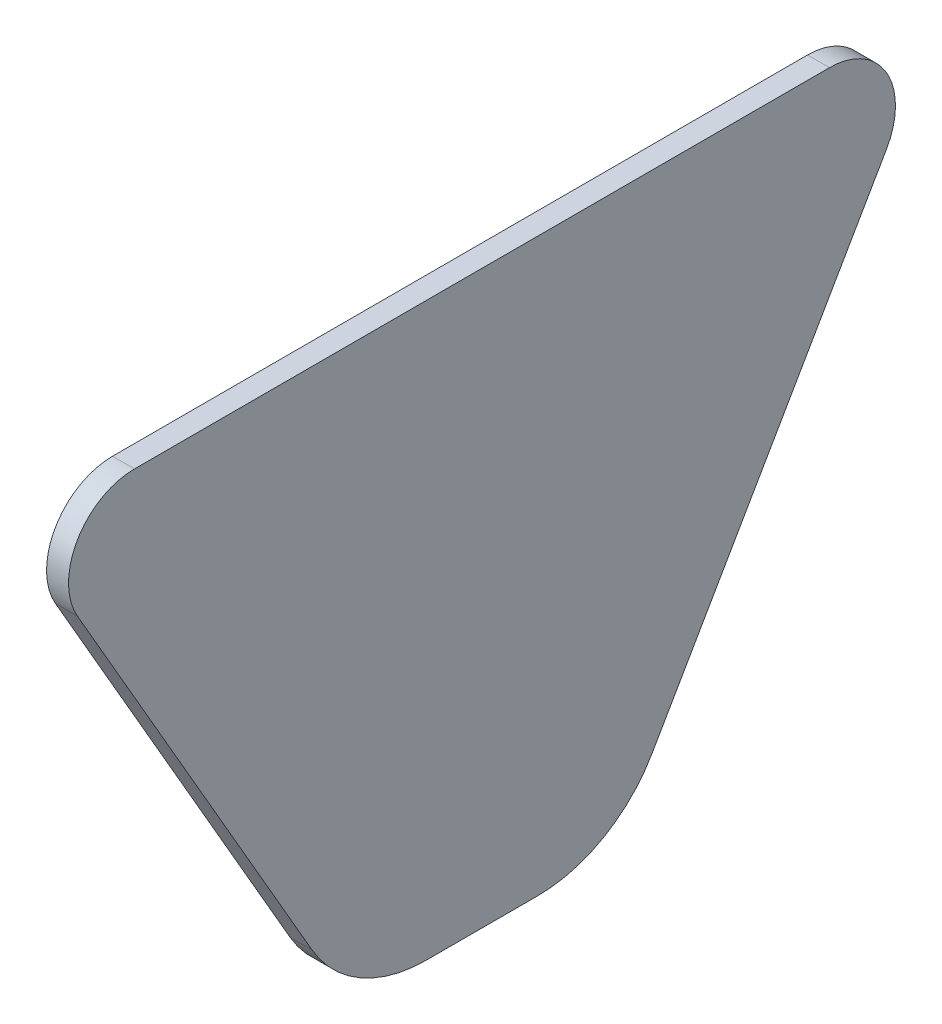
from build123d import *

# Parameters (mm, degrees)
EXTRUDE_1_DEPTH     = 0.5
EXTRUDE_2_DEPTH     = 2
FILLET_1_R          = 0.3
CUT_EXTRUDE_1_DEPTH = 0.05
CUT_EXTRUDE_2_DEPTH = 0.05
CUT_EXTRUDE_3_DEPTH = 0.05
SKETCH_6_R          = 0.4
SKETCH_6_R_2        = 0.3
CUT_EXTRUDE_4_DEPTH = 0.05


with BuildPart() as part:
    # Эскиз1 → Бобышка-Вытянуть1 (new, symmetric)
    with BuildSketch(Plane(origin=(0, 0, 0), x_dir=(0, 0, -1), z_dir=(1, 0, 0))):
        with BuildLine():
            Line((2.535898385, -52), (-2.535898385, -52))
            ThreePointArc((-2.535898385, -52), (-5.535898385, -51.196152423), (-7.732050808, -49))
            Line((-7.732050808, -49), (-18.413030788, -30.5))
            ThreePointArc((-18.413030788, -30.5), (-18.413030788, -27.5), (-15.814954576, -26))
            Line((-15.814954576, -26), (15.814954576, -26))
            ThreePointArc((15.814954576, -26), (18.413030788, -27.5), (18.413030788, -30.5))
            Line((18.413030788, -30.5), (7.732050808, -49))
            ThreePointArc((7.732050808, -49), (5.535898385, -51.196152423), (2.535898385, -52))
        make_face()
    extrude(amount=EXTRUDE_1_DEPTH, both=True)

    # Эскиз2 → Бобышка-Вытянуть2 (add)
    with BuildSketch(Plane.ZY.offset(0.5)):
        with BuildLine():
            Line((1.728674855, -43), (-1.728674855, -43))
            ThreePointArc((-1.728674855, -43), (-2.005954761, -43.039210817), (-2.261489924, -43.153768293))
            ThreePointArc((-2.261489924, -43.153768293), (-3.79502764, -44.668303078), (-4.548555907, -46.687646708))
            ThreePointArc((-4.548555907, -46.687646708), (-4.544377659, -46.993552015), (-4.447909552, -47.283878416))
            ThreePointArc((-4.447909552, -47.283878416), (0, -50), (4.447909552, -47.283878416))
            ThreePointArc((4.447909552, -47.283878416), (4.544377659, -46.993552015), (4.548555907, -46.687646708))
            ThreePointArc((4.548555907, -46.687646708), (3.79502764, -44.668303078), (2.261489924, -43.153768293))
            ThreePointArc((2.261489924, -43.153768293), (2.005954761, -43.039210817), (1.728674855, -43))
        make_face()
        with BuildLine():
            ThreePointArc((6.849999027, -30.437634022), (9.817391211, -29.83648895), (12.7337664, -29.023133227))
            ThreePointArc((12.7337664, -29.023133227), (13.636842461, -29.175983342), (14.036664122, -30.00002956))
            ThreePointArc((14.036664122, -30.00002956), (12.155161452, -36.681608438), (7.295503302, -41.638146673))
            ThreePointArc((7.295503302, -41.638146673), (4.194836252, -41.229561749), (3.91920073, -38.114260343))
            ThreePointArc((3.91920073, -38.114260343), (5.447269784, -34.910587582), (6.013250548, -31.406564185))
            ThreePointArc((6.013250548, -31.406564185), (6.256250043, -30.770649024), (6.849999027, -30.437634022))
        make_face()
        with BuildLine():
            ThreePointArc((-3.91920073, -38.114260343), (-5.447269784, -34.910587582), (-6.013250548, -31.406564185))
            ThreePointArc((-6.013250548, -31.406564185), (-6.256250043, -30.770649024), (-6.849999027, -30.437634022))
            ThreePointArc((-6.849999027, -30.437634022), (-9.817391211, -29.83648895), (-12.7337664, -29.023133227))
            ThreePointArc((-12.7337664, -29.023133227), (-13.636842461, -29.175983342), (-14.036664122, -30.00002956))
            ThreePointArc((-14.036664122, -30.00002956), (-12.155161452, -36.681608438), (-7.295503302, -41.638146673))
            ThreePointArc((-7.295503302, -41.638146673), (-4.194836252, -41.229561749), (-3.91920073, -38.114260343))
        make_face()
    extrude(amount=EXTRUDE_2_DEPTH)

    # Скругление1
    fillet_1_edges = [part.edges().sort_by_distance(p)[0] for p in [
        (-2.5, -46.993552015, -4.544377659),
        (-2.5, -50, 0),
        (-2.5, -46.993552015, 4.544377659),
        (-2.5, -44.668303078, 3.79502764),
        (-2.5, -43.039210817, 2.005954761),
        (-2.5, -43, 0),
        (-2.5, -43.039210817, -2.005954761),
        (-2.5, -44.668303078, -3.79502764),
        (-2.5, -36.681608438, 12.155161452),
        (-2.5, -29.175983342, 13.636842461),
        (-2.5, -29.83648895, 9.817391211),
        (-2.5, -30.770649024, 6.256250043),
        (-2.5, -34.910587582, 5.447269784),
        (-2.5, -41.229561749, 4.194836252),
        (-2.5, -41.229561749, -4.194836252),
        (-2.5, -34.910587582, -5.447269784),
        (-2.5, -30.770649024, -6.256250043),
        (-2.5, -29.83648895, -9.817391211),
        (-2.5, -29.175983342, -13.636842461),
        (-2.5, -36.681608438, -12.155161452),
    ]]
    fillet(fillet_1_edges, radius=FILLET_1_R)

    # Эскиз3 → Вырез-Вытянуть1 (cut)
    # profile 1 of 2: a face of its own
    with BuildSketch(Plane.ZY.offset(2.5)):
        Polygon((0, -44), (-2.424871131, -48.2), (2.424871131, -48.2), align=None)
        Polygon((0, -44.4), (-2.078460969, -48), (2.078460969, -48), align=None, mode=Mode.SUBTRACT)
    # profile 2 of 2: a face of its own
    with BuildSketch(Plane.ZY.offset(2.5)):
        Polygon((0, -46), (0.052293446, -46.202283181), (0.138918542, -46.012153798), (0.155291427, -46.220444504), (0.273616115, -46.048245903), (0.253570957, -46.256215328), (0.4, -46.107179677), (0.344145862, -46.308508773), (0.514230088, -46.187164446), (0.424264069, -46.375735931), (0.612835554, -46.285769912), (0.491491227, -46.455854138), (0.692820323, -46.4), (0.543784672, -46.546429043), (0.751754097, -46.526383885), (0.579555496, -46.644708573), (0.787846202, -46.661081458), (0.597716819, -46.747706554), (0.8, -46.8), (0.597716819, -46.852293446), (0.787846202, -46.938918542), (0.579555496, -46.955291427), (0.751754097, -47.073616115), (0.543784672, -47.053570957), (0.692820323, -47.2), (0.491491227, -47.144145862), (0.612835554, -47.314230088), (0.424264069, -47.224264069), (0.514230088, -47.412835554), (0.344145862, -47.291491227), (0.4, -47.492820323), (0.253570957, -47.343784672), (0.273616115, -47.551754097), (0.155291427, -47.379555496), (0.138918542, -47.587846202), (0.052293446, -47.397716819), (0, -47.6), (-0.052293446, -47.397716819), (-0.138918542, -47.587846202), (-0.155291427, -47.379555496), (-0.273616115, -47.551754097), (-0.253570957, -47.343784672), (-0.4, -47.492820323), (-0.344145862, -47.291491227), (-0.514230088, -47.412835554), (-0.424264069, -47.224264069), (-0.612835554, -47.314230088), (-0.491491227, -47.144145862), (-0.692820323, -47.2), (-0.543784672, -47.053570957), (-0.751754097, -47.073616115), (-0.579555496, -46.955291427), (-0.787846202, -46.938918542), (-0.597716819, -46.852293446), (-0.8, -46.8), (-0.597716819, -46.747706554), (-0.787846202, -46.661081458), (-0.579555496, -46.644708573), (-0.751754097, -46.526383885), (-0.543784672, -46.546429043), (-0.692820323, -46.4), (-0.491491227, -46.455854138), (-0.612835554, -46.285769912), (-0.424264069, -46.375735931), (-0.514230088, -46.187164446), (-0.344145862, -46.308508773), (-0.4, -46.107179677), (-0.253570957, -46.256215328), (-0.273616115, -46.048245903), (-0.155291427, -46.220444504), (-0.138918542, -46.012153798), (-0.052293446, -46.202283181), align=None)
    extrude(amount=-CUT_EXTRUDE_1_DEPTH, mode=Mode.SUBTRACT)

    # Эскиз4 → Вырез-Вытянуть2 (cut)
    with BuildSketch(Plane.ZY.offset(2.5)):
        with BuildLine():
            Line((8.3, -36.326649916), (8.3, -37.7))
            Line((8.3, -37.7), (9.7, -37.7))
            Line((9.7, -37.7), (9.7, -36.326649916))
            ThreePointArc((9.7, -36.326649916), (9, -33.5), (8.3, -36.326649916))
        make_face()
        with BuildLine():
            Line((7.429551733, -36.079903811), (6.909936491, -36.379903811))
            ThreePointArc((6.909936491, -36.379903811), (6.70503268, -36.325), (6.759936491, -36.120096189))
            Line((6.759936491, -36.120096189), (7.279551733, -35.820096189))
            ThreePointArc((7.279551733, -35.820096189), (7.484455543, -35.875), (7.429551733, -36.079903811))
        make_face()
        with BuildLine():
            Line((7.203563787, -35.63664506), (6.624008291, -35.791936487))
            ThreePointArc((6.624008291, -35.791936487), (6.44029656, -35.68587047), (6.546362578, -35.502158739))
            Line((6.546362578, -35.502158739), (7.125918073, -35.346867312))
            ThreePointArc((7.125918073, -35.346867312), (7.309629804, -35.452933329), (7.203563787, -35.63664506))
        make_face()
        with BuildLine():
            Line((7.1, -35.15), (6.5, -35.15))
            ThreePointArc((6.5, -35.15), (6.35, -35), (6.5, -34.85))
            Line((6.5, -34.85), (7.1, -34.85))
            ThreePointArc((7.1, -34.85), (7.25, -35), (7.1, -35.15))
        make_face()
        with BuildLine():
            Line((7.125918073, -34.653132688), (6.546362578, -34.497841261))
            ThreePointArc((6.546362578, -34.497841261), (6.44029656, -34.31412953), (6.624008291, -34.208063513))
            Line((6.624008291, -34.208063513), (7.203563787, -34.36335494))
            ThreePointArc((7.203563787, -34.36335494), (7.309629804, -34.547066671), (7.125918073, -34.653132688))
        make_face()
        with BuildLine():
            Line((7.279551733, -34.179903811), (6.759936491, -33.879903811))
            ThreePointArc((6.759936491, -33.879903811), (6.70503268, -33.675), (6.909936491, -33.620096189))
            Line((6.909936491, -33.620096189), (7.429551733, -33.920096189))
            ThreePointArc((7.429551733, -33.920096189), (7.484455543, -34.125), (7.279551733, -34.179903811))
        make_face()
        with BuildLine():
            Line((7.550431099, -33.762563133), (7.12616703, -33.338299064))
            ThreePointArc((7.12616703, -33.338299064), (7.12616703, -33.12616703), (7.338299064, -33.12616703))
            Line((7.338299064, -33.12616703), (7.762563133, -33.550431099))
            ThreePointArc((7.762563133, -33.550431099), (7.762563133, -33.762563133), (7.550431099, -33.762563133))
        make_face()
        with BuildLine():
            Line((7.920096189, -33.429551733), (7.620096189, -32.909936491))
            ThreePointArc((7.620096189, -32.909936491), (7.675, -32.70503268), (7.879903811, -32.759936491))
            Line((7.879903811, -32.759936491), (8.179903811, -33.279551733))
            ThreePointArc((8.179903811, -33.279551733), (8.125, -33.484455543), (7.920096189, -33.429551733))
        make_face()
        with BuildLine():
            Line((8.36335494, -33.203563787), (8.208063513, -32.624008291))
            ThreePointArc((8.208063513, -32.624008291), (8.31412953, -32.44029656), (8.497841261, -32.546362578))
            Line((8.497841261, -32.546362578), (8.653132688, -33.125918073))
            ThreePointArc((8.653132688, -33.125918073), (8.547066671, -33.309629804), (8.36335494, -33.203563787))
        make_face()
        with BuildLine():
            Line((8.85, -33.1), (8.85, -32.5))
            ThreePointArc((8.85, -32.5), (9, -32.35), (9.15, -32.5))
            Line((9.15, -32.5), (9.15, -33.1))
            ThreePointArc((9.15, -33.1), (9, -33.25), (8.85, -33.1))
        make_face()
        with BuildLine():
            Line((9.346867312, -33.125918073), (9.502158739, -32.546362578))
            ThreePointArc((9.502158739, -32.546362578), (9.68587047, -32.44029656), (9.791936487, -32.624008291))
            Line((9.791936487, -32.624008291), (9.63664506, -33.203563787))
            ThreePointArc((9.63664506, -33.203563787), (9.452933329, -33.309629804), (9.346867312, -33.125918073))
        make_face()
        with BuildLine():
            Line((9.820096189, -33.279551733), (10.120096189, -32.759936491))
            ThreePointArc((10.120096189, -32.759936491), (10.325, -32.70503268), (10.379903811, -32.909936491))
            Line((10.379903811, -32.909936491), (10.079903811, -33.429551733))
            ThreePointArc((10.079903811, -33.429551733), (9.875, -33.484455543), (9.820096189, -33.279551733))
        make_face()
        with BuildLine():
            Line((10.237436867, -33.550431099), (10.661700936, -33.12616703))
            ThreePointArc((10.661700936, -33.12616703), (10.87383297, -33.12616703), (10.87383297, -33.338299064))
            Line((10.87383297, -33.338299064), (10.449568901, -33.762563133))
            ThreePointArc((10.449568901, -33.762563133), (10.237436867, -33.762563133), (10.237436867, -33.550431099))
        make_face()
        with BuildLine():
            Line((10.570448267, -33.920096189), (11.090063509, -33.620096189))
            ThreePointArc((11.090063509, -33.620096189), (11.29496732, -33.675), (11.240063509, -33.879903811))
            Line((11.240063509, -33.879903811), (10.720448267, -34.179903811))
            ThreePointArc((10.720448267, -34.179903811), (10.515544457, -34.125), (10.570448267, -33.920096189))
        make_face()
        with BuildLine():
            Line((10.796436213, -34.36335494), (11.375991709, -34.208063513))
            ThreePointArc((11.375991709, -34.208063513), (11.55970344, -34.31412953), (11.453637422, -34.497841261))
            Line((11.453637422, -34.497841261), (10.874081927, -34.653132688))
            ThreePointArc((10.874081927, -34.653132688), (10.690370196, -34.547066671), (10.796436213, -34.36335494))
        make_face()
        with BuildLine():
            Line((10.9, -34.85), (11.5, -34.85))
            ThreePointArc((11.5, -34.85), (11.65, -35), (11.5, -35.15))
            Line((11.5, -35.15), (10.9, -35.15))
            ThreePointArc((10.9, -35.15), (10.75, -35), (10.9, -34.85))
        make_face()
        with BuildLine():
            Line((10.874081927, -35.346867312), (11.453637422, -35.502158739))
            ThreePointArc((11.453637422, -35.502158739), (11.55970344, -35.68587047), (11.375991709, -35.791936487))
            Line((11.375991709, -35.791936487), (10.796436213, -35.63664506))
            ThreePointArc((10.796436213, -35.63664506), (10.690370196, -35.452933329), (10.874081927, -35.346867312))
        make_face()
        with BuildLine():
            Line((10.720448267, -35.820096189), (11.240063509, -36.120096189))
            ThreePointArc((11.240063509, -36.120096189), (11.29496732, -36.325), (11.090063509, -36.379903811))
            Line((11.090063509, -36.379903811), (10.570448267, -36.079903811))
            ThreePointArc((10.570448267, -36.079903811), (10.515544457, -35.875), (10.720448267, -35.820096189))
        make_face()
    extrude(amount=-CUT_EXTRUDE_2_DEPTH, mode=Mode.SUBTRACT)

    # Эскиз5 → Вырез-Вытянуть3 (cut)
    with BuildSketch(Plane.ZY.offset(2.5)):
        with BuildLine():
            Line((-9.867593445, -34.998843991), (-9.757016522, -35.387666106))
            add(Edge.make_bspline(
                [(-9.757016522, -35.387666106), (-9.796350104, -35.398045158), (-9.873273459, -35.418343119), (-9.988806662, -35.438727115), (-10.101088945, -35.450394247), (-10.210410923, -35.452732957), (-10.316570315, -35.447000056), (-10.419589701, -35.432038306), (-10.519530434, -35.407747292), (-10.616127445, -35.374841877), (-10.708886982, -35.333067961), (-10.797429625, -35.28400532), (-10.880832646, -35.22626508), (-10.959831657, -35.161123454), (-11.034307616, -35.088261906), (-11.104472299, -35.007875641), (-11.169597199, -34.919398831), (-11.208028861, -34.855733701), (-11.227569406, -34.823363222)],
                knots=[0, 0, 0, 0, 1.139565781, 2.228610196, 3.283749768, 4.300051564, 5.289630971, 6.259753573, 7.212819077, 8.167882849, 9.115177773, 10.060074562, 11.00055889, 11.953624394, 12.926196333, 13.916873743, 14.940836292, 16, 16, 16, 16], degree=3))
            add(Edge.make_bspline(
                [(-11.227569406, -34.823363222), (-11.24660707, -34.789319985), (-11.283843418, -34.722733781), (-11.331547249, -34.621606062), (-11.372824229, -34.522949824), (-11.403523636, -34.425147211), (-11.428281407, -34.329617765), (-11.443743059, -34.235479521), (-11.451967625, -34.143250143), (-11.451262759, -34.052523049), (-11.44266537, -33.963531436), (-11.427413236, -33.875801939), (-11.406204661, -33.788925574), (-11.375994807, -33.703779578), (-11.340989275, -33.618927165), (-11.296961262, -33.536091608), (-11.247404259, -33.453749864), (-11.190659306, -33.373274535), (-11.128493491, -33.295349141), (-11.06240758, -33.219837885), (-10.991725732, -33.148504244), (-10.917967708, -33.079616645), (-10.839502124, -33.014956383), (-10.757810884, -32.952763562), (-10.671911217, -32.894428954), (-10.612164528, -32.858731917), (-10.582136714, -32.840791106)],
                knots=[0, 0, 0, 0, 1.187233096, 2.322145419, 3.402670267, 4.440396927, 5.440388644, 6.404990075, 7.341531893, 8.256433945, 9.163146917, 10.060581172, 10.965898126, 11.882100391, 12.808718967, 13.758082345, 14.735061039, 15.733395952, 16.753569982, 17.769139061, 18.786994946, 19.809863807, 20.84068468, 21.8812216, 22.93513287, 24, 24, 24, 24], degree=3))
            add(Edge.make_bspline(
                [(-10.582136714, -32.840791106), (-10.549084097, -32.822182006), (-10.483857981, -32.785458761), (-10.384107032, -32.737798121), (-10.285180001, -32.69590842), (-10.186575324, -32.660692597), (-10.087974489, -32.633577928), (-9.990274457, -32.611148922), (-9.892753901, -32.597197868), (-9.796065757, -32.588533368), (-9.700649881, -32.58645922), (-9.607100964, -32.592226801), (-9.515496913, -32.60346026), (-9.425948121, -32.621218321), (-9.338854501, -32.64684169), (-9.254065788, -32.678955054), (-9.170715152, -32.716510158), (-9.090564818, -32.761873074), (-9.013312531, -32.812350653), (-8.939043314, -32.866840627), (-8.869213831, -32.926963824), (-8.802500888, -32.990718268), (-8.740425602, -33.060074699), (-8.681352109, -33.133139408), (-8.626645383, -33.211449648), (-8.593455054, -33.266282094), (-8.57672806, -33.293916106)],
                knots=[0, 0, 0, 0, 1.178218728, 2.325099735, 3.432475402, 4.515141555, 5.575246676, 6.608108121, 7.627378692, 8.633202109, 9.622972626, 10.589296422, 11.54268595, 12.488651865, 13.422231474, 14.359744576, 15.30390701, 16.25965019, 17.217741238, 18.170012778, 19.119167351, 20.078732992, 21.034962411, 22.008912623, 22.996547879, 24, 24, 24, 24], degree=3))
            add(Edge.make_bspline(
                [(-8.57672806, -33.293916106), (-8.5590357, -33.325728334), (-8.524343074, -33.38810835), (-8.481152225, -33.484025101), (-8.445900358, -33.579328618), (-8.419232522, -33.674587519), (-8.401356238, -33.769918562), (-8.390596394, -33.864951454), (-8.38985953, -33.959694013), (-8.396123341, -34.053629075), (-8.411418011, -34.14627526), (-8.434092864, -34.23722881), (-8.465268218, -34.325846464), (-8.502855326, -34.413158334), (-8.550238238, -34.497501879), (-8.604398071, -34.580223922), (-8.666552666, -34.66056901), (-8.712968591, -34.711110526), (-8.736583829, -34.73682476)],
                knots=[0, 0, 0, 0, 1.111996521, 2.180493682, 3.210834104, 4.214869263, 5.199380386, 6.172193173, 7.133379688, 8.090737693, 9.045822616, 9.999022269, 10.951533655, 11.91373334, 12.900164868, 13.903621327, 14.933416027, 16, 16, 16, 16], degree=3))
            Line((-8.736583829, -34.73682476), (-9.008218445, -34.448964183))
            add(Edge.make_bspline(
                [(-9.008218445, -34.448964183), (-8.989890754, -34.428379084), (-8.95415925, -34.388246556), (-8.906890176, -34.325419147), (-8.865037115, -34.263418909), (-8.829271347, -34.201549425), (-8.800481348, -34.139472925), (-8.77735935, -34.077854393), (-8.760238798, -34.016571289), (-8.750205568, -33.955093476), (-8.745111972, -33.893769744), (-8.746563202, -33.832000816), (-8.753233234, -33.769896877), (-8.765209921, -33.707102929), (-8.783431055, -33.644068658), (-8.807150961, -33.580697994), (-8.83579425, -33.516894397), (-8.858867212, -33.475446361), (-8.870598252, -33.454372837)],
                knots=[0, 0, 0, 0, 1.213608636, 2.366040693, 3.459999426, 4.507416146, 5.510131306, 6.470607331, 7.403948095, 8.307705253, 9.210514217, 10.110732124, 11.024769314, 11.959277276, 12.922869307, 13.91123269, 14.938003084, 16, 16, 16, 16], degree=3))
            add(Edge.make_bspline(
                [(-8.870598252, -33.454372837), (-8.884892336, -33.430523844), (-8.912994099, -33.383637398), (-8.959956454, -33.318258524), (-9.009646054, -33.258320995), (-9.061373344, -33.203536407), (-9.116842942, -33.155399618), (-9.173721249, -33.111589313), (-9.234283122, -33.074269755), (-9.297171756, -33.042692727), (-9.361633536, -33.016068138), (-9.427358551, -32.995032139), (-9.494024451, -32.979132592), (-9.561661972, -32.969963808), (-9.629929627, -32.964579187), (-9.699038844, -32.96640731), (-9.76923235, -32.971913587), (-9.863355253, -32.988863996), (-9.980273231, -33.017186115), (-10.117262671, -33.063279182), (-10.250548504, -33.119999298), (-10.335304555, -33.166586324), (-10.377809791, -33.18994976)],
                knots=[0, 0, 0, 0, 0.961110548, 1.889516143, 2.779936074, 3.651980823, 4.491251322, 5.316920163, 6.131915142, 6.946615719, 7.747986173, 8.54096067, 9.330630776, 10.11429338, 10.898965525, 11.69565237, 12.50212553, 13.331128897, 14.999362458, 16.657499405, 18.323732935, 20, 20, 20, 20], degree=3))
            add(Edge.make_bspline(
                [(-10.377809791, -33.18994976), (-10.404366115, -33.205789272), (-10.456643546, -33.236970131), (-10.531982115, -33.286274308), (-10.602742907, -33.337480634), (-10.669800873, -33.38943149), (-10.731566092, -33.444066325), (-10.790231451, -33.498886057), (-10.843563248, -33.556288935), (-10.892978039, -33.61442999), (-10.937638254, -33.673706293), (-10.976316488, -33.734551167), (-11.008691392, -33.796637792), (-11.036091211, -33.85959824), (-11.057928676, -33.923610758), (-11.072780086, -33.989135388), (-11.082491176, -34.055447307), (-11.086629859, -34.122581388), (-11.085460152, -34.189497101), (-11.078986608, -34.255448886), (-11.069889245, -34.320437047), (-11.055091747, -34.384183186), (-11.036740201, -34.44700754), (-11.012791384, -34.508104882), (-10.98620864, -34.568764793), (-10.964481008, -34.607385261), (-10.953530945, -34.626848798)],
                knots=[0, 0, 0, 0, 1.270367035, 2.50078007, 3.697704673, 4.858456209, 5.984219707, 7.084543751, 8.155953211, 9.201345861, 10.218626818, 11.202738379, 12.15991154, 13.092567132, 14.021729892, 14.934119117, 15.848992147, 16.772597576, 17.694551317, 18.595434354, 19.494021089, 20.388527782, 21.281708241, 22.180483418, 23.083019177, 24, 24, 24, 24], degree=3))
            add(Edge.make_bspline(
                [(-10.953530945, -34.626848798), (-10.939450043, -34.649909063), (-10.911855384, -34.695100779), (-10.86518322, -34.758165988), (-10.814772, -34.815123465), (-10.760957412, -34.866671219), (-10.703627712, -34.912501872), (-10.642844672, -34.952997559), (-10.578223786, -34.987403131), (-10.510138753, -35.015521303), (-10.439282422, -35.038082557), (-10.365316105, -35.052886636), (-10.288695247, -35.061575475), (-10.209279972, -35.062100468), (-10.12719452, -35.057907286), (-10.042756344, -35.04444977), (-9.955542302, -35.025551216), (-9.897331054, -35.007874342), (-9.867593445, -34.998843991)],
                knots=[0, 0, 0, 0, 1.032239438, 2.022902761, 2.993725712, 3.935902682, 4.86728725, 5.79517279, 6.723310952, 7.660248021, 8.606986116, 9.560386685, 10.538547145, 11.54921228, 12.592183908, 13.675969074, 14.812753087, 16, 16, 16, 16], degree=3))
        make_face()
        Polygon((-10.524990466, -36.037711925), (-7.446865466, -35.245043656), (-7.300831812, -35.49684654), (-10.37835585, -36.290716733), align=None)
        Polygon((-9.154386103, -38.302632525), (-6.593688988, -36.817656564), (-5.591886103, -38.545420987), (-5.894169757, -38.720901756), (-6.699458219, -37.332079641), (-7.492727449, -37.791815218), (-6.795612065, -38.993738295), (-7.097294757, -39.169219064), (-7.794410142, -37.967295987), (-8.95787168, -38.641574833), align=None)
    extrude(amount=-CUT_EXTRUDE_3_DEPTH, mode=Mode.SUBTRACT)

    # Эскиз6 → Вырез-Вытянуть4 (cut)
    # profile 1 of 2: a face of its own
    with BuildSketch(Plane.ZY.offset(2.5)):
        with Locations((-7.021764228, -36.198914822)):
            Circle(SKETCH_6_R)
        with Locations((-7.021764228, -36.198914822)):
            Circle(SKETCH_6_R_2, mode=Mode.SUBTRACT)
    # profile 2 of 2: a face of its own
    with BuildSketch(Plane.ZY.offset(2.5)):
        with Locations((-9.527865347, -31.872316021)):
            Circle(SKETCH_6_R)
        with Locations((-9.527865347, -31.872316021)):
            Circle(SKETCH_6_R_2, mode=Mode.SUBTRACT)
    extrude(amount=-CUT_EXTRUDE_4_DEPTH, mode=Mode.SUBTRACT)


solid = part.part
